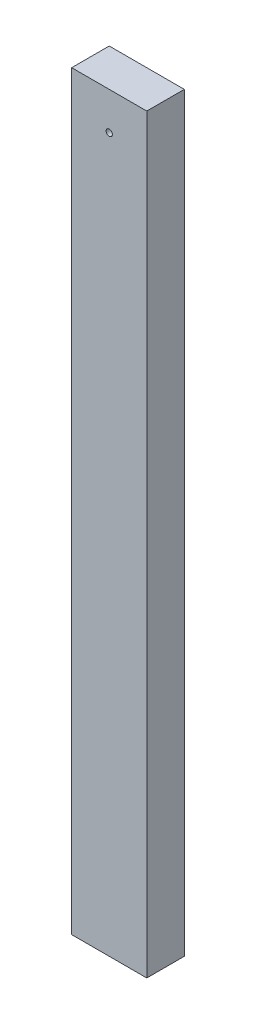
from build123d import *

# Parameters (mm, degrees)
SKETCH1_W           = 152.4
SKETCH1_H           = 76.2
BOSS_EXTRUDE1_DEPTH = 1524
CUT_EXTRUDE1_REACH  = 1529.805
SKETCH2_R           = 6.35


with BuildPart() as part:
    # Sketch1 → Boss-Extrude1 (new body)
    with BuildSketch(Plane(origin=(0, 0, 0), x_dir=(1, 0, 0), z_dir=(0, 1, 0))):
        Rectangle(SKETCH1_W, SKETCH1_H)
    extrude(amount=BOSS_EXTRUDE1_DEPTH)

    # Sketch2 → Cut-Extrude1 (cut, up to next)
    with BuildSketch(Plane.XY.offset(38.1), mode=Mode.PRIVATE) as cut_extrude1_sk1:
        with Locations((0, 1447.8)):
            Circle(SKETCH2_R)
    cut_extrude1_tool1 = extrude(cut_extrude1_sk1.sketch, amount=-CUT_EXTRUDE1_REACH, mode=Mode.PRIVATE) & part.part
    add(cut_extrude1_tool1.solids().sort_by_distance((0, 1447.8, 38.1))[0], mode=Mode.SUBTRACT)


solid = part.part
